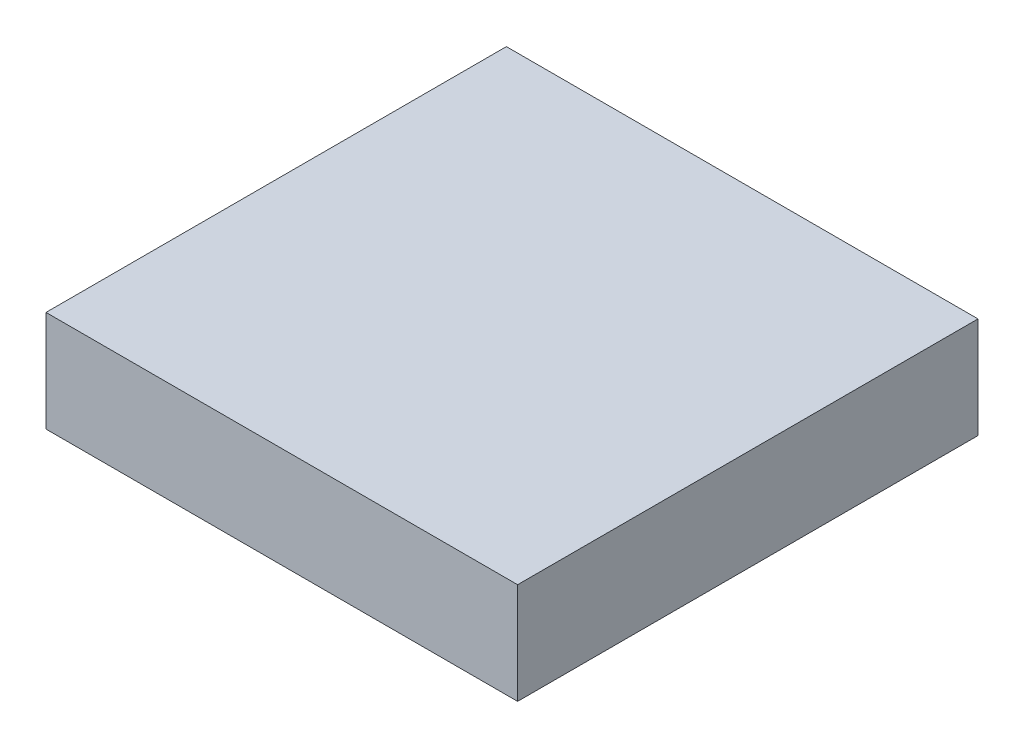
from build123d import *

# Parameters (mm, degrees)
SKETCH1_W           = 106.68
SKETCH1_H           = 104.14
BOSS_EXTRUDE1_DEPTH = 22.86


with BuildPart() as part:
    # Sketch1 → Boss-Extrude1 (new body)
    with BuildSketch(Plane(origin=(0, 0, 0), x_dir=(1, 0, 0), z_dir=(0, 1, 0))):
        Rectangle(SKETCH1_W, SKETCH1_H)
    extrude(amount=BOSS_EXTRUDE1_DEPTH)


solid = part.part
